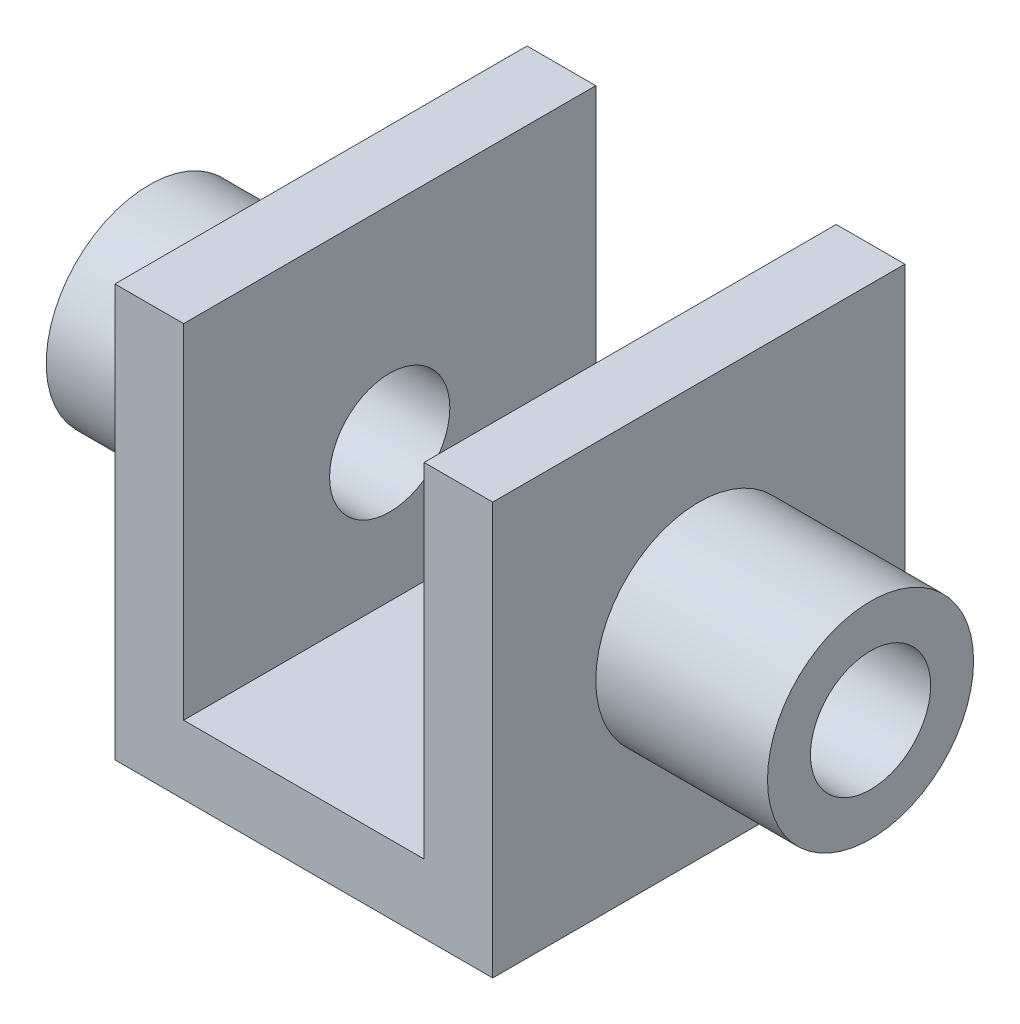
from build123d import *

# Parameters (mm, degrees)
BOSS_EXTRUDE1_DEPTH     = 24
SKETCH2_R               = 12
SKETCH2_R_2             = 7
BOSS_EXTRUDE2_DEPTH     = 20
CUT_EXTRUDE1_DEPTH      = 70.397406292
CUT_EXTRUDE1_DEPTH_BACK = 70.397406292
SKETCH3_R               = 7


with BuildPart() as part:
    # Sketch1 → Boss-Extrude1 (new, symmetric)
    with BuildSketch(Plane.XY):
        Polygon((0, 0), (44, 0), (44, 47.073103448), (44, 48), (36, 48), (36, 8), (8, 8), (8, 48), (0, 48), align=None)
    extrude(amount=BOSS_EXTRUDE1_DEPTH, both=True)

    # Sketch2 → Boss-Extrude2 (add)
    with BuildSketch(Plane(origin=(44, 0, 0), x_dir=(0, 0, -1), z_dir=(1, 0, 0))):
        with Locations(Location((0, 24, 0), (0, 0, 180))):
            Circle(SKETCH2_R)
        with Locations((0, 24)):
            Circle(SKETCH2_R_2, mode=Mode.SUBTRACT)
    boss_extrude2 = extrude(amount=BOSS_EXTRUDE2_DEPTH)

    # Sketch3 → Cut-Extrude1 (cut, two sides: drawn at the far end of the back side and taken through both)
    with BuildSketch(Plane(origin=(44, 0, 0), x_dir=(0, 0, -1), z_dir=(1, 0, 0)).offset(-CUT_EXTRUDE1_DEPTH_BACK)):
        with Locations((0, 24)):
            Circle(SKETCH3_R)
    extrude(amount=CUT_EXTRUDE1_DEPTH + CUT_EXTRUDE1_DEPTH_BACK, mode=Mode.SUBTRACT)

    # Mirror1: Boss-Extrude2 across plane
    add(boss_extrude2.mirror(Plane.ZY.offset(-22)))


solid = part.part
